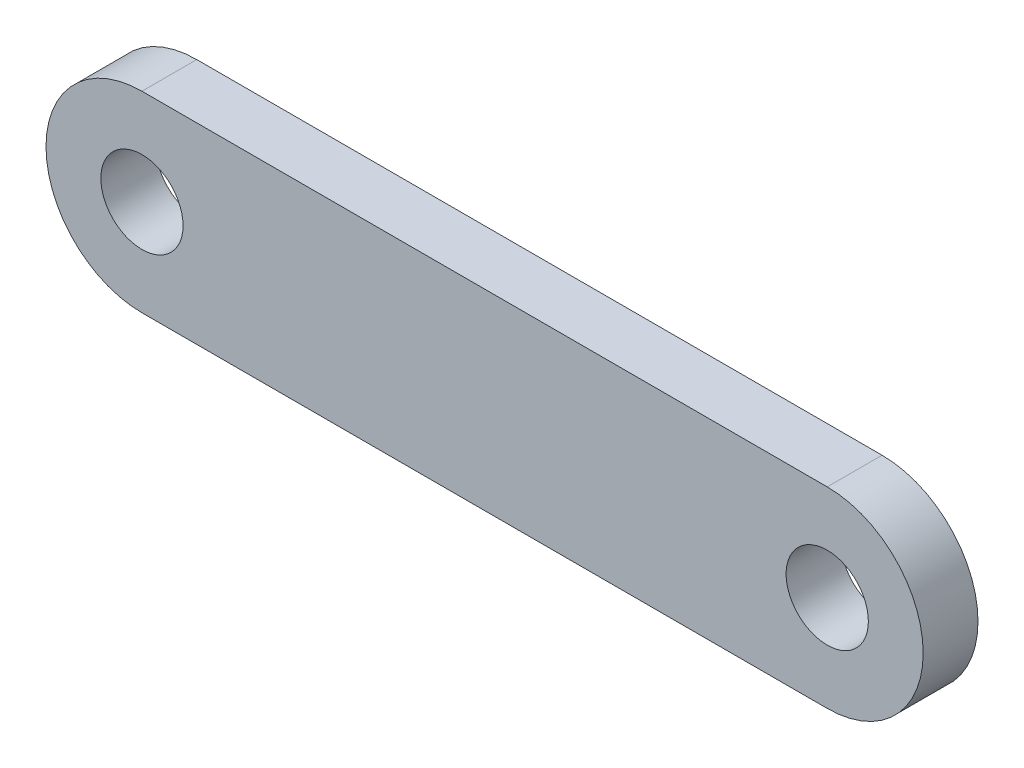
from build123d import *

# Parameters (mm, degrees)
SKETCH_1_R      = 1.5
EXTRUDE_1_DEPTH = 1


with BuildPart() as part:
    # 草图1 → 凸台-拉伸1 (new, symmetric)
    with BuildSketch(Plane.XY):
        with BuildLine():
            Line((-12.5, 3.5), (12.5, 3.5))
            ThreePointArc((12.5, 3.5), (16, 0), (12.5, -3.5))
            Line((12.5, -3.5), (-12.5, -3.5))
            ThreePointArc((-12.5, -3.5), (-16, 0), (-12.5, 3.5))
        make_face()
        with Locations((12.5, 0)):
            Circle(SKETCH_1_R, mode=Mode.SUBTRACT)
        with Locations((-12.5, 0)):
            Circle(SKETCH_1_R, mode=Mode.SUBTRACT)
    extrude(amount=EXTRUDE_1_DEPTH, both=True)


solid = part.part
